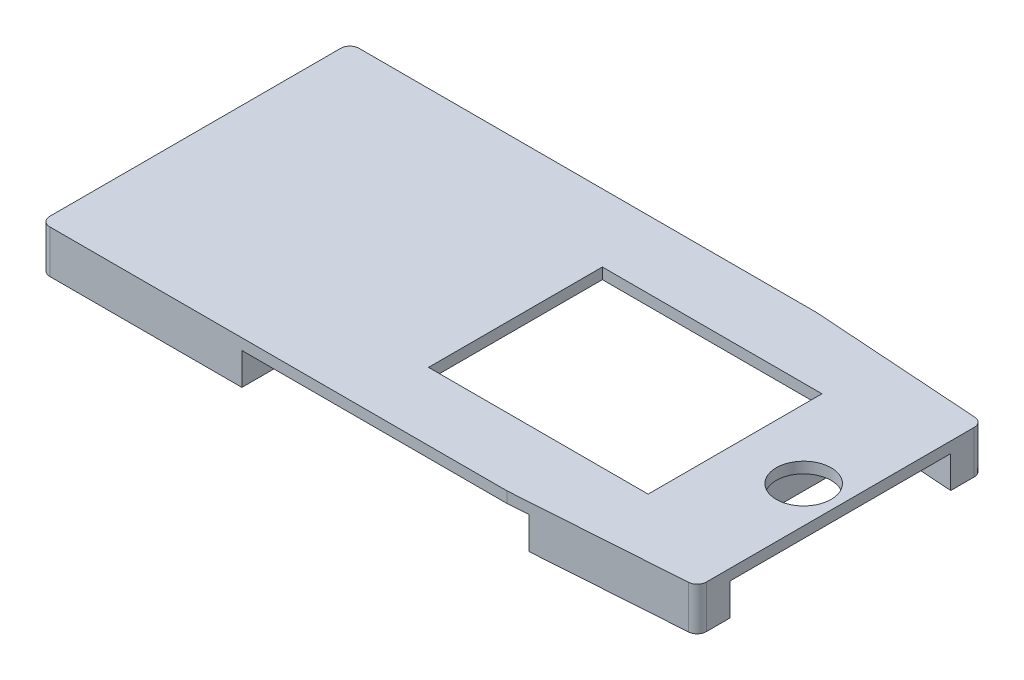
from build123d import *

# Parameters (mm, degrees)
SKETCH1_R           = 3
SKETCH1_W           = 24
SKETCH1_H           = 19
BOSS_EXTRUDE1_DEPTH = 1.2
SKETCH2_W           = 3.5
SKETCH2_H           = 19
BOSS_EXTRUDE2_DEPTH = 3.5
FILLET1_R           = 1


with BuildPart() as part:
    # Sketch1 → Boss-Extrude1 (new body)
    with BuildSketch(Plane(origin=(0, 0, 0), x_dir=(1, 0, 0), z_dir=(0, 1, 0))):
        Polygon((51, 33.8), (70.5, 32.475), (70.5, 1.325), (51, 0), (0, 0), (0, 33.8), align=None)
        with Locations(Location((66.5, 16.9, 0), (0, 0, 270))):
            Circle(SKETCH1_R, mode=Mode.SUBTRACT)
        with Locations((47, 16.9)):
            Rectangle(SKETCH1_W, SKETCH1_H, mode=Mode.SUBTRACT)
    extrude(amount=BOSS_EXTRUDE1_DEPTH)

    # Sketch2 → Boss-Extrude2 (add)
    with BuildSketch(Plane.XZ):
        Polygon((0, 0), (22, 0), (22, -3.5), (3.5, -3.5), (3.5, -30.3), (22, -30.3), (22, -33.8), (4.40507534, -33.8), (0, -33.8), (0, -3.5), align=None)
        Polygon((53.236727535, -0.151982768), (70.5, -1.325), (70.5, -4.825), (53, -3.635897436), align=None)
        Polygon((70.5, -32.475), (53.236727535, -33.648017232), (53, -30.164102564), (70.5, -28.975), align=None)
        with Locations((60.75, -16.9)):
            Rectangle(SKETCH2_W, SKETCH2_H)
    extrude(amount=BOSS_EXTRUDE2_DEPTH)

    # Fillet1
    fillet1_edges = [part.edges().sort_by_distance(p)[0] for p in [
        (0, -1.15, -33.8),
        (70.5, -1.15, -32.475),
        (70.5, -1.15, -1.325),
        (0, -1.15, 0),
    ]]
    fillet(fillet1_edges, radius=FILLET1_R)


solid = part.part
